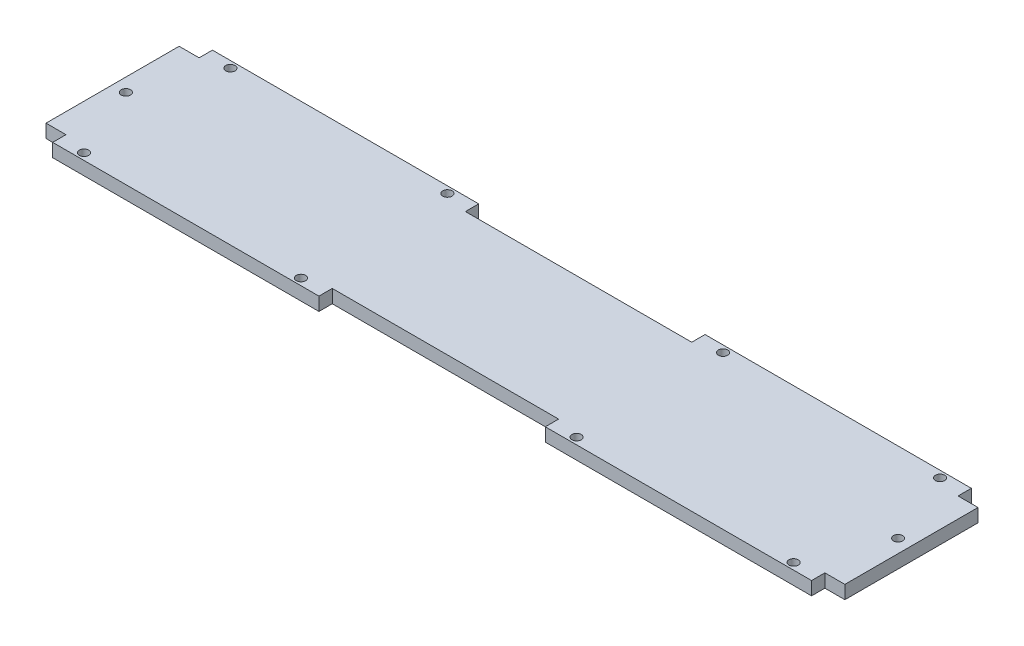
from build123d import *

# Parameters (mm, degrees)
SKETCH1_W           = 100
SKETCH1_H           = 5
SKETCH1_R           = 1.75
SKETCH1_W_2         = 300
SKETCH1_H_2         = 50
BOSS_EXTRUDE1_DEPTH = 5
SKETCH2_R           = 1.75
CUT_EXTRUDE1_DEPTH  = 10


with BuildPart() as part:
    # Sketch1 → Boss-Extrude1 (new body)
    # profile 1 of 5: a face of its own
    with BuildSketch(Plane(origin=(0, 0, 0), x_dir=(1, 0, 0), z_dir=(0, 1, 0))):
        with Locations((-92.5, -2.5)):
            Rectangle(SKETCH1_W, SKETCH1_H)
        with Locations(Location((-51.75, -2.5, 0), (0, 0, 270))):
            Circle(SKETCH1_R, mode=Mode.SUBTRACT)
        with Locations(Location((-133.25, -2.5, 0), (0, 0, 270))):
            Circle(SKETCH1_R, mode=Mode.SUBTRACT)
    # profile 2 of 5: a face of its own
    with BuildSketch(Plane(origin=(0, 0, 0), x_dir=(1, 0, 0), z_dir=(0, 1, 0))):
        with Locations((0, 25)):
            Rectangle(SKETCH1_W_2, SKETCH1_H_2)
    # profile 3 of 5: a face of its own
    with BuildSketch(Plane(origin=(0, 0, 0), x_dir=(1, 0, 0), z_dir=(0, 1, 0))):
        with Locations((92.5, -2.5)):
            Rectangle(SKETCH1_W, SKETCH1_H)
        with Locations(Location((51.75, -2.5, 0), (0, 0, 270))):
            Circle(SKETCH1_R, mode=Mode.SUBTRACT)
        with Locations(Location((133.25, -2.5, 0), (0, 0, 270))):
            Circle(SKETCH1_R, mode=Mode.SUBTRACT)
    # profile 4 of 5: a face of its own
    with BuildSketch(Plane(origin=(0, 0, 0), x_dir=(1, 0, 0), z_dir=(0, 1, 0))):
        with Locations((92.5, 52.5)):
            Rectangle(SKETCH1_W, SKETCH1_H)
        with Locations(Location((133.25, 52.5, 0), (0, 0, 90))):
            Circle(SKETCH1_R, mode=Mode.SUBTRACT)
        with Locations(Location((51.75, 52.5, 0), (0, 0, 270))):
            Circle(SKETCH1_R, mode=Mode.SUBTRACT)
    # profile 5 of 5: a face of its own
    with BuildSketch(Plane(origin=(0, 0, 0), x_dir=(1, 0, 0), z_dir=(0, 1, 0))):
        with Locations((-92.5, 52.5)):
            Rectangle(SKETCH1_W, SKETCH1_H)
        with Locations(Location((-51.75, 52.5, 0), (0, 0, 90))):
            Circle(SKETCH1_R, mode=Mode.SUBTRACT)
        with Locations(Location((-133.25, 52.5, 0), (0, 0, 270))):
            Circle(SKETCH1_R, mode=Mode.SUBTRACT)
    extrude(amount=BOSS_EXTRUDE1_DEPTH)

    # Sketch2 → Cut-Extrude1 (cut)
    with BuildSketch(Plane(origin=(0, 5, 0), x_dir=(1, 0, 0), z_dir=(0, 1, 0))):
        with Locations(Location((-145, 25, 0), (0, 0, 270))):
            Circle(SKETCH2_R)
        with Locations(Location((145, 25, 0), (0, 0, 270))):
            Circle(SKETCH2_R)
    extrude(amount=-CUT_EXTRUDE1_DEPTH, mode=Mode.SUBTRACT)


solid = part.part
